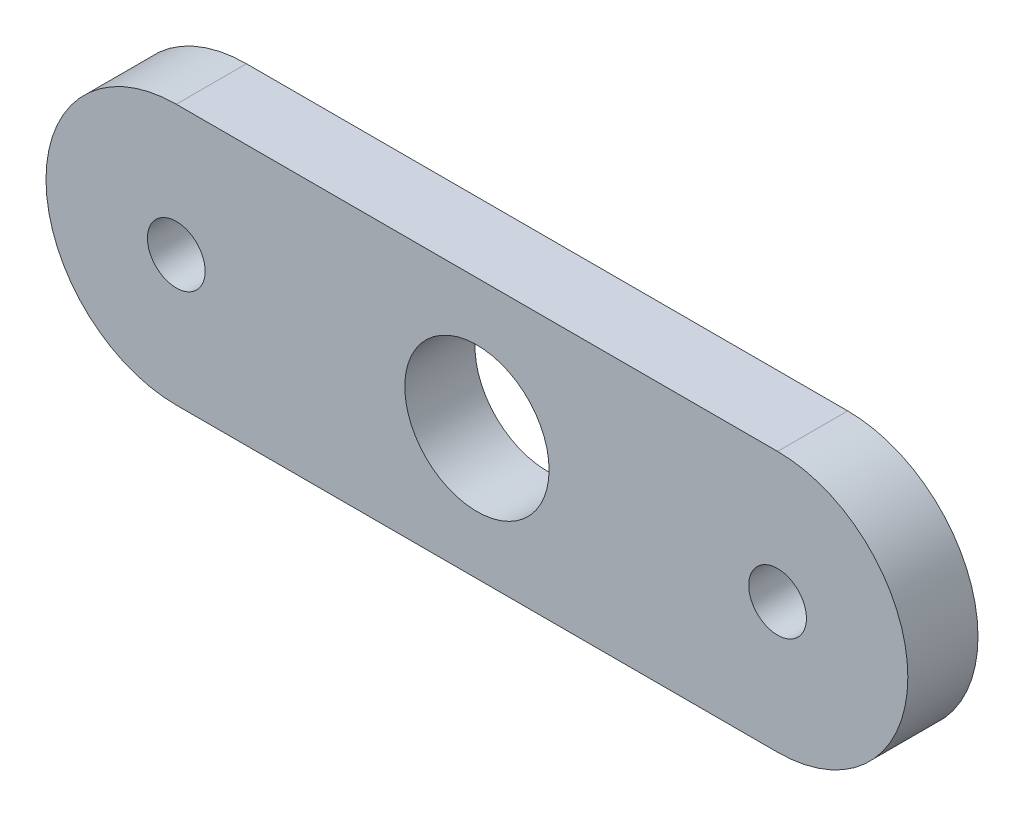
from build123d import *

# Parameters (mm, degrees)
SKETCH_1_R      = 1.44
SKETCH_1_R_2    = 3.6
EXTRUDE_2_DEPTH = 2
SKETCH_1_2_R    = 1.44
SKETCH_1_2_R_2  = 3.6
EXTRUDE_3_DEPTH = 3.5


with BuildPart() as part:
    # 草图1 → 凸台-拉伸2 (new body)
    with BuildSketch(Plane.XY):
        with BuildLine():
            Line((-15, 6.5), (15, 6.5))
            ThreePointArc((15, 6.5), (21.5, 0), (15, -6.5))
            Line((15, -6.5), (-15, -6.5))
            ThreePointArc((-15, -6.5), (-21.5, 0), (-15, 6.5))
        make_face()
        with Locations((-15, 0)):
            Circle(SKETCH_1_R, mode=Mode.SUBTRACT)
        with Locations((15, 0)):
            Circle(SKETCH_1_R, mode=Mode.SUBTRACT)
        Circle(SKETCH_1_R_2, mode=Mode.SUBTRACT)
    extrude(amount=EXTRUDE_2_DEPTH)

    # 草图1<2> → 凸台-拉伸3 (add)
    with BuildSketch(Plane.XY):
        with BuildLine():
            Line((-15, 6.5), (15, 6.5))
            ThreePointArc((15, 6.5), (21.5, 0), (15, -6.5))
            Line((15, -6.5), (-15, -6.5))
            ThreePointArc((-15, -6.5), (-21.5, 0), (-15, 6.5))
        make_face()
        with Locations((-15, 0)):
            Circle(SKETCH_1_2_R, mode=Mode.SUBTRACT)
        with Locations((15, 0)):
            Circle(SKETCH_1_2_R, mode=Mode.SUBTRACT)
        Circle(SKETCH_1_2_R_2, mode=Mode.SUBTRACT)
    extrude(amount=EXTRUDE_3_DEPTH)


solid = part.part
